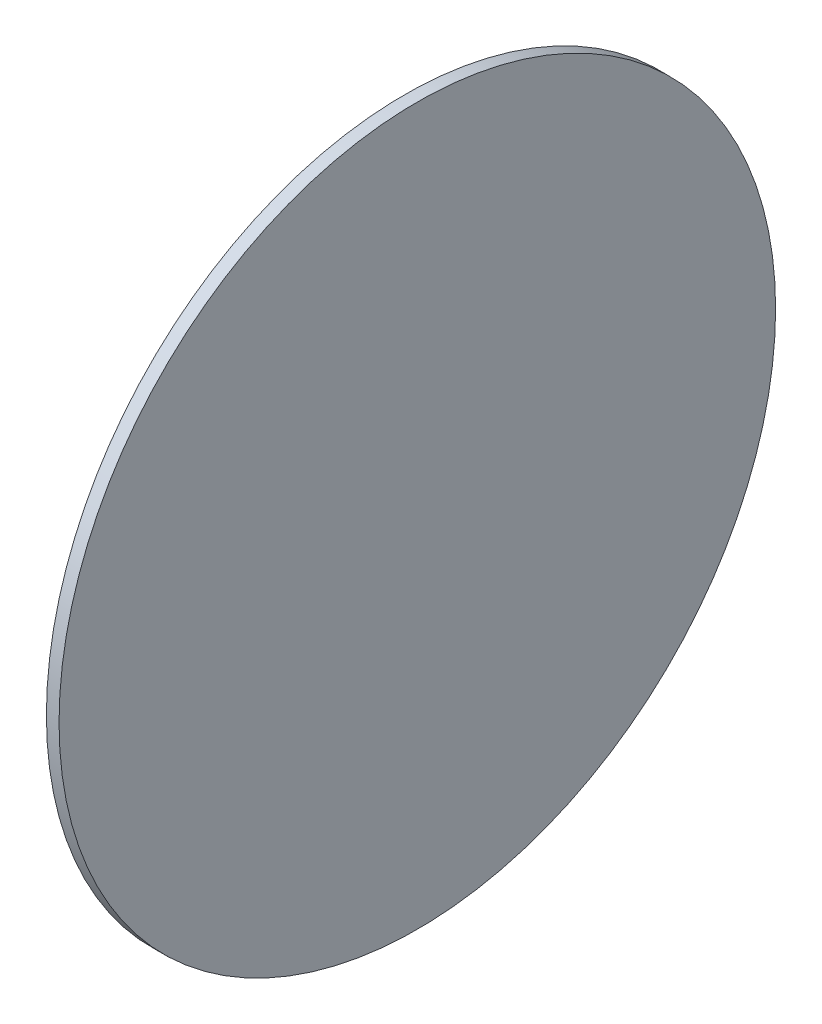
from build123d import *

# Parameters (mm, degrees)
SKIZZE1_R                       = 51
AUFSATZ_LINEAR_AUSTRAGEN1_DEPTH = 1.8


with BuildPart() as part:
    # Skizze1 → Aufsatz-Linear austragen1 (new body)
    with BuildSketch(Plane(origin=(0, 0, 0), x_dir=(0, 0, -1), z_dir=(1, 0, 0))):
        Circle(SKIZZE1_R)
    extrude(amount=AUFSATZ_LINEAR_AUSTRAGEN1_DEPTH)


solid = part.part
